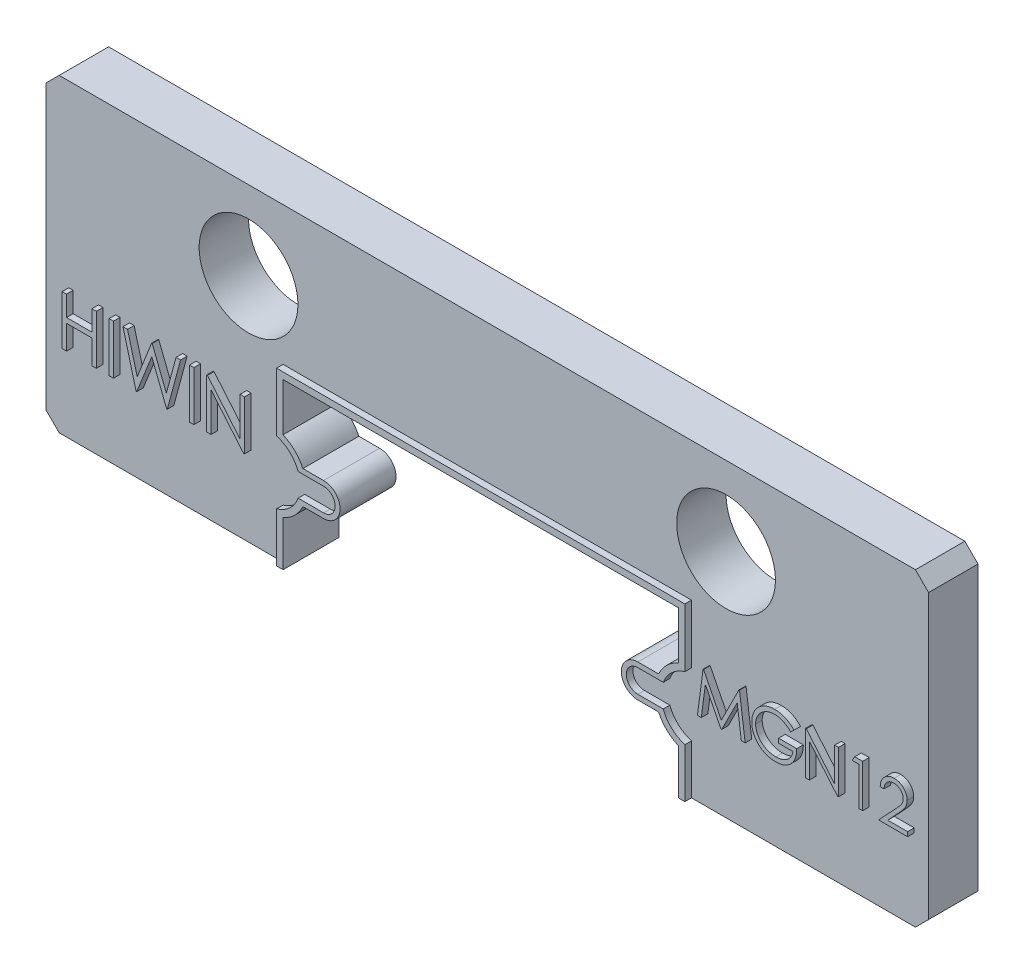
from build123d import *

# Parameters (mm, degrees)
BOSS_EXTRUDE1_DEPTH = 1.5
SKETCH2_R           = 1.5
CUT_EXTRUDE1_DEPTH  = 15.279355728
SKETCH3_W           = 0.134615385
SKETCH3_H           = 1.5
SKETCH3_W_2         = 0.134615384
BOSS_EXTRUDE2_DEPTH = 0.2
BOSS_EXTRUDE3_START = 0.2
BOSS_EXTRUDE3_DEPTH = 0.2


with BuildPart() as part:
    # Sketch1 → Boss-Extrude1 (new body)
    with BuildSketch(Plane.XY):
        with BuildLine():
            Line((-6, -4.7), (-13, -4.7))
            Line((-13, -4.7), (-13.4, -4.3))
            Line((-13.4, -4.3), (-13.4, 4.3))
            Line((-13.4, 4.3), (-13, 4.7))
            Line((-13, 4.7), (13, 4.7))
            Line((13, 4.7), (13.4, 4.3))
            Line((13.4, 4.3), (13.4, -4.3))
            Line((13.4, -4.3), (13, -4.7))
            Line((13, -4.7), (6, -4.7))
            Line((6, -4.7), (6, -3.328898526))
            ThreePointArc((6, -3.328898526), (5.646338178, -3.089180762), (5.400138898, -2.74))
            Line((5.400138898, -2.74), (4.77, -2.74))
            ThreePointArc((4.77, -2.74), (4.27, -2.24), (4.77, -1.74))
            Line((4.77, -1.74), (5.400138898, -1.74))
            ThreePointArc((5.400138898, -1.74), (5.646338178, -1.390819238), (6, -1.151101474))
            Line((6, -1.151101474), (6, 0.3))
            Line((6, 0.3), (-6, 0.3))
            Line((-6, 0.3), (-6, -1.151101474))
            ThreePointArc((-6, -1.151101474), (-5.646338178, -1.390819238), (-5.400138898, -1.74))
            Line((-5.400138898, -1.74), (-4.77, -1.74))
            ThreePointArc((-4.77, -1.74), (-4.27, -2.24), (-4.77, -2.74))
            Line((-4.77, -2.74), (-5.400138898, -2.74))
            ThreePointArc((-5.400138898, -2.74), (-5.646338178, -3.089180762), (-6, -3.328898526))
            Line((-6, -3.328898526), (-6, -4.7))
        make_face()
    extrude(amount=-BOSS_EXTRUDE1_DEPTH)

    # Sketch2 → Cut-Extrude1 (cut, through all)
    with BuildSketch(Plane.XY):
        with Locations((-7.25, 2.3)):
            Circle(SKETCH2_R)
        with Locations((7.25, 2.3)):
            Circle(SKETCH2_R)
    extrude(amount=-CUT_EXTRUDE1_DEPTH, mode=Mode.SUBTRACT)

    # Sketch3 → Boss-Extrude2 (add)
    with BuildSketch(Plane.XY):
        Polygon((-8.324615385, -2.24), (-8.324615385, -0.74), (-8.296370192, -0.74), (-7.305384615, -1.920588942), (-7.305384615, -0.74), (-7.170769231, -0.74), (-7.170769231, -2.24), (-7.201418269, -2.24), (-8.19, -1.062115385), (-8.19, -2.24), align=None)
        with Locations((-8.776538462, -1.49)):
            Rectangle(SKETCH3_W, SKETCH3_H)
        Polygon((-10.863076923, -0.74), (-10.723954327, -0.74), (-10.430384615, -1.840060096), (-9.993786058, -0.74), (-9.974254808, -0.74), (-9.545769231, -1.832548077), (-9.250697115, -0.74), (-9.113076923, -0.74), (-9.517524038, -2.24), (-9.536754808, -2.24), (-9.988076923, -1.092764423), (-10.444807692, -2.24), (-10.464038462, -2.24), align=None)
        with Locations((-11.218846154, -1.49)):
            Rectangle(SKETCH3_W_2, SKETCH3_H)
        Polygon((-12.709230769, -0.74), (-12.574615385, -0.74), (-12.574615385, -1.355384615), (-11.805384615, -1.355384615), (-11.805384615, -0.74), (-11.670769231, -0.74), (-11.670769231, -2.24), (-11.805384615, -2.24), (-11.805384615, -1.509230769), (-12.574615385, -1.509230769), (-12.574615385, -2.24), (-12.709230769, -2.24), align=None)
        Polygon((6.58, -2.24), (6.751614583, -0.94), (6.76828125, -0.94), (7.305, -2.006666667), (7.840416667, -0.94), (7.85734375, -0.94), (8.03, -2.24), (7.9128125, -2.24), (7.788333333, -1.304583333), (7.3190625, -2.24), (7.292760417, -2.24), (6.821666667, -1.3025), (6.697447917, -2.24), align=None)
        with BuildLine():
            Line((9.513333333, -1.161875), (9.413333333, -1.256666667))
            add(Edge.make_bspline(
                [(9.413333333, -1.256666667), (9.395237746, -1.239643775), (9.359478072, -1.206003911), (9.301178553, -1.16235697), (9.240352061, -1.124966704), (9.17731599, -1.094544388), (9.113631385, -1.070270506), (9.050143553, -1.052988625), (8.987503721, -1.041967397), (8.945841612, -1.040649431), (8.9253125, -1.04)],
                knots=[0, 0, 0, 0, 1.08915593, 2.152340314, 3.188132944, 4.216796309, 5.218260357, 6.173443236, 7.099959455, 8, 8, 8, 8], degree=3))
            add(Edge.make_bspline(
                [(8.9253125, -1.04), (8.912715611, -1.040153625), (8.887554505, -1.040460477), (8.85018064, -1.0443769), (8.813198746, -1.050009563), (8.776678636, -1.058159404), (8.740549301, -1.068488483), (8.704936398, -1.081408798), (8.669773495, -1.096472174), (8.635391807, -1.113878236), (8.60205962, -1.132999322), (8.57057851, -1.15418878), (8.540747819, -1.176767473), (8.513128232, -1.201300694), (8.487560877, -1.227566215), (8.463437196, -1.255075443), (8.441605629, -1.284579953), (8.421886054, -1.3155369), (8.404294596, -1.34740257), (8.388765667, -1.379870252), (8.375729606, -1.412832255), (8.365415237, -1.446329941), (8.356905565, -1.48010416), (8.350919025, -1.514388771), (8.347543957, -1.549220482), (8.346960153, -1.572545178), (8.346666667, -1.584270833)],
                knots=[0, 0, 0, 0, 1.02818874, 2.053710826, 3.065248034, 4.081641283, 5.106893873, 6.131558223, 7.173050175, 8.228653731, 9.27666206, 10.308777013, 11.325269123, 12.329503258, 13.32196095, 14.316845687, 15.314881793, 16.315733098, 17.311955233, 18.285320748, 19.252783886, 20.203351036, 21.145449891, 22.095197417, 23.042428769, 24, 24, 24, 24], degree=3))
            add(Edge.make_bspline(
                [(8.346666667, -1.584270833), (8.346947362, -1.596257137), (8.347507986, -1.620197013), (8.351096105, -1.65592624), (8.357755166, -1.691124818), (8.366657458, -1.725908411), (8.377793189, -1.760336588), (8.391674465, -1.794260092), (8.408115974, -1.827677666), (8.427146693, -1.860288209), (8.448015854, -1.892053904), (8.471394713, -1.921976012), (8.496228644, -1.950452986), (8.523422378, -1.976852556), (8.552103923, -2.00188086), (8.583130197, -2.02484834), (8.61589111, -2.046197394), (8.650436646, -2.065658958), (8.686391965, -2.083044986), (8.723258759, -2.09850529), (8.761154805, -2.111237615), (8.799880947, -2.121614625), (8.839391019, -2.13012045), (8.879885575, -2.135592514), (8.921066866, -2.139563394), (8.94882693, -2.139853729), (8.9628125, -2.14)],
                knots=[0, 0, 0, 0, 0.93586088, 1.869166235, 2.799637598, 3.729985548, 4.670839027, 5.622275134, 6.589130586, 7.576015415, 8.568469353, 9.55398029, 10.53834874, 11.515998671, 12.510579167, 13.508179873, 14.527009472, 15.561807829, 16.601455013, 17.643573243, 18.680854198, 19.719860599, 20.772568776, 21.833555941, 22.908541556, 24, 24, 24, 24], degree=3))
            add(Edge.make_bspline(
                [(8.9628125, -2.14), (8.979667315, -2.139647672), (9.012764482, -2.138955818), (9.061416589, -2.133569996), (9.108143444, -2.12515833), (9.152813748, -2.112839568), (9.195479384, -2.097126775), (9.236296762, -2.078185631), (9.274944521, -2.055289638), (9.311538843, -2.029447916), (9.345248655, -2.000656692), (9.375651615, -1.969588752), (9.402262797, -1.936394898), (9.425478828, -1.901270638), (9.444684899, -1.863925239), (9.460449366, -1.824541716), (9.47253316, -1.783102354), (9.477493579, -1.75446832), (9.48, -1.74)],
                knots=[0, 0, 0, 0, 1.13008108, 2.219097802, 3.278683437, 4.311054135, 5.322181354, 6.324827112, 7.324222904, 8.330512327, 9.32562643, 10.293043162, 11.24128371, 12.174520618, 13.111833804, 14.052305215, 15.015860969, 16, 16, 16, 16], degree=3))
            Line((9.48, -1.74), (9.046666667, -1.74))
            Line((9.046666667, -1.74), (9.046666667, -1.606666667))
            Line((9.046666667, -1.606666667), (9.596666667, -1.606666667))
            add(Edge.make_bspline(
                [(9.596666667, -1.606666667), (9.596033066, -1.63151802), (9.594792995, -1.680156607), (9.58609454, -1.751088421), (9.572048407, -1.818083622), (9.552860291, -1.881212763), (9.528020901, -1.940386383), (9.497796819, -1.995664562), (9.461704317, -2.046690186), (9.42102901, -2.093879816), (9.375380455, -2.135973523), (9.32599211, -2.172970015), (9.272782379, -2.204133843), (9.215801593, -2.229487804), (9.15523629, -2.249275287), (9.09094632, -2.26330473), (9.023018868, -2.271710145), (8.976465245, -2.272784086), (8.95265625, -2.273333333)],
                knots=[0, 0, 0, 0, 1.140356446, 2.231883559, 3.274166699, 4.278491846, 5.25512956, 6.21435461, 7.1637429, 8.11826594, 9.068280886, 10.0076534, 10.945064095, 11.891975133, 12.864533718, 13.863980011, 14.907571808, 16, 16, 16, 16], degree=3))
            add(Edge.make_bspline(
                [(8.95265625, -2.273333333), (8.937981057, -2.273121945), (8.909036846, -2.27270502), (8.866288787, -2.269742006), (8.824719385, -2.265180649), (8.784334696, -2.25829246), (8.744986169, -2.249855588), (8.706870323, -2.23905195), (8.669841962, -2.226546433), (8.633843853, -2.212322326), (8.599202736, -2.195841425), (8.565764315, -2.177526416), (8.533343754, -2.157471739), (8.502161893, -2.135330568), (8.472056262, -2.111268511), (8.443220983, -2.085237341), (8.415494628, -2.05731664), (8.398126456, -2.03749015), (8.389375, -2.0275)],
                knots=[0, 0, 0, 0, 1.107784379, 2.184907829, 3.233506516, 4.263428166, 5.276301166, 6.270063455, 7.25232949, 8.225834625, 9.190232166, 10.146266622, 11.1027726, 12.066435141, 13.031522626, 14.010570082, 14.99756817, 16, 16, 16, 16], degree=3))
            add(Edge.make_bspline(
                [(8.389375, -2.0275), (8.376677368, -2.0116509), (8.351492872, -1.98021578), (8.319075271, -1.929850086), (8.291440464, -1.877700824), (8.26901813, -1.823622819), (8.251509698, -1.767666654), (8.23895309, -1.709903832), (8.231596097, -1.650259969), (8.230536212, -1.609898585), (8.23, -1.589479167)],
                knots=[0, 0, 0, 0, 1.023165419, 2.029347347, 3.013907458, 3.994755782, 4.975994455, 5.96558838, 6.970761222, 8, 8, 8, 8], degree=3))
            add(Edge.make_bspline(
                [(8.23, -1.589479167), (8.230197688, -1.574188844), (8.230590553, -1.54380253), (8.235354316, -1.498689816), (8.242189128, -1.45437813), (8.252235177, -1.410903695), (8.264899504, -1.368237475), (8.280705085, -1.32635966), (8.299107475, -1.285245536), (8.320496373, -1.2451781), (8.344299172, -1.206689032), (8.370132111, -1.169933276), (8.39836202, -1.135580195), (8.428527888, -1.103194726), (8.460989628, -1.073183726), (8.495443128, -1.045269342), (8.531914941, -1.01941413), (8.570519808, -0.996025334), (8.610681519, -0.975015989), (8.652303805, -0.956597139), (8.695373961, -0.941374765), (8.73956931, -0.92845879), (8.785224381, -0.918907452), (8.832007867, -0.911980775), (8.880163622, -0.907241123), (8.912714148, -0.906859943), (8.92921875, -0.906666667)],
                knots=[0, 0, 0, 0, 1.008945113, 2.00506715, 2.99143336, 3.967273523, 4.948097931, 5.927297278, 6.919902385, 7.919676788, 8.923139349, 9.905703106, 10.883022732, 11.856032218, 12.825136022, 13.798837087, 14.781400844, 15.773989409, 16.776158564, 17.77167057, 18.775803737, 19.789618931, 20.80898985, 21.851988756, 22.910860228, 24, 24, 24, 24], degree=3))
            add(Edge.make_bspline(
                [(8.92921875, -0.906666667), (8.942678669, -0.906881906), (8.969368107, -0.907308702), (9.009083379, -0.910267), (9.048184784, -0.91495587), (9.086730301, -0.92135439), (9.124588665, -0.930069475), (9.161867727, -0.940498553), (9.198621526, -0.95264123), (9.234734876, -0.967122801), (9.270450599, -0.983559862), (9.305967283, -1.00206199), (9.341163574, -1.022945563), (9.37610051, -1.046272591), (9.4109984, -1.071642432), (9.445305267, -1.09978068), (9.479849218, -1.129577704), (9.50206132, -1.151002515), (9.513333333, -1.161875)],
                knots=[0, 0, 0, 0, 0.985871117, 1.954866573, 2.915460327, 3.869826059, 4.81536089, 5.759505086, 6.70452669, 7.649098992, 8.607881297, 9.583363685, 10.581137262, 11.603961102, 12.659522466, 13.73993555, 14.853081303, 16, 16, 16, 16], degree=3))
        make_face()
        Polygon((9.863333333, -2.24), (9.863333333, -0.94), (9.8878125, -0.94), (10.746666667, -1.963177083), (10.746666667, -0.94), (10.863333333, -0.94), (10.863333333, -2.24), (10.836770833, -2.24), (9.98, -1.219166667), (9.98, -2.24), align=None)
        Polygon((11.356302083, -0.94), (11.596666667, -0.94), (11.596666667, -2.24), (11.48, -2.24), (11.48, -1.073333333), (11.28, -1.073333333), align=None)
        with BuildLine():
            Line((12.246666667, -1.34), (12.13, -1.34))
            add(Edge.make_bspline(
                [(12.13, -1.34), (12.130760371, -1.324522242), (12.13225372, -1.294124336), (12.139247084, -1.249804028), (12.149253696, -1.207440817), (12.16340195, -1.167374849), (12.180972853, -1.129251864), (12.202044006, -1.093223286), (12.227001722, -1.059426559), (12.255307081, -1.028174989), (12.286049718, -0.99950532), (12.319220496, -0.974747658), (12.35407722, -0.953829666), (12.39051414, -0.936342347), (12.428942349, -0.923216119), (12.469013125, -0.913476653), (12.510902518, -0.907616867), (12.539443098, -0.906987004), (12.553958333, -0.906666667)],
                knots=[0, 0, 0, 0, 1.10065271, 2.161652631, 3.183658789, 4.190468796, 5.17591951, 6.163126047, 7.15150782, 8.156236427, 9.156009102, 10.134482811, 11.092018607, 12.041330605, 13.001268258, 13.972401359, 14.968799086, 16, 16, 16, 16], degree=3))
            add(Edge.make_bspline(
                [(12.553958333, -0.906666667), (12.568213047, -0.907000379), (12.596223049, -0.907656112), (12.637103226, -0.913287351), (12.676020506, -0.922107143), (12.71289882, -0.93448144), (12.747443929, -0.951115656), (12.779915346, -0.971097599), (12.810699647, -0.994207822), (12.838410738, -1.021416381), (12.863856596, -1.050462981), (12.885808862, -1.081472774), (12.904608037, -1.113500794), (12.920277747, -1.146791269), (12.931812884, -1.181657651), (12.940570505, -1.217592327), (12.945520687, -1.254967256), (12.946280415, -1.280263977), (12.946666667, -1.293125)],
                knots=[0, 0, 0, 0, 1.111607364, 2.184268762, 3.212621178, 4.221274766, 5.211760367, 6.196651075, 7.1921475, 8.207485113, 9.220403448, 10.201281604, 11.166441695, 12.114753415, 13.065576456, 14.026450734, 14.996634279, 16, 16, 16, 16], degree=3))
            add(Edge.make_bspline(
                [(12.946666667, -1.293125), (12.94603774, -1.311231339), (12.944790925, -1.347126275), (12.934125585, -1.399874653), (12.917468309, -1.45098078), (12.897412148, -1.492111778), (12.877179526, -1.525255647), (12.858947023, -1.552544023), (12.837602951, -1.581926054), (12.812836651, -1.613303351), (12.785160442, -1.646921687), (12.754323638, -1.682760754), (12.720106345, -1.720450268), (12.69609033, -1.746192349), (12.683645833, -1.75953125)],
                knots=[0, 0, 0, 0, 1.184426356, 2.348067706, 3.509069118, 4.696110526, 5.333549288, 6.050745305, 6.844228056, 7.710549037, 8.667450064, 9.695053472, 10.805634456, 12, 12, 12, 12], degree=3))
            Line((12.683645833, -1.75953125), (12.358385417, -2.106666667))
            Line((12.358385417, -2.106666667), (12.963333333, -2.106666667))
            Line((12.963333333, -2.106666667), (12.963333333, -2.24))
            Line((12.963333333, -2.24), (12.08, -2.24))
            Line((12.08, -2.24), (12.584166667, -1.701979167))
            add(Edge.make_bspline(
                [(12.584166667, -1.701979167), (12.596441596, -1.68916551), (12.620019223, -1.664553098), (12.653367038, -1.628619998), (12.683318662, -1.595284455), (12.710067979, -1.564609451), (12.73303471, -1.536146297), (12.753415824, -1.510816836), (12.769745901, -1.48750804), (12.787468762, -1.460490098), (12.804633955, -1.427502666), (12.819384259, -1.387190152), (12.828378346, -1.345691459), (12.829457284, -1.317647845), (12.83, -1.303541667)],
                knots=[0, 0, 0, 0, 1.329631726, 2.553950428, 3.673215718, 4.687767853, 5.603093632, 6.413772471, 7.123043292, 7.734684054, 8.834405432, 9.900288307, 10.943827018, 12, 12, 12, 12], degree=3))
            add(Edge.make_bspline(
                [(12.83, -1.303541667), (12.829763867, -1.294671433), (12.829298495, -1.277189906), (12.82519135, -1.251559195), (12.81898459, -1.226835121), (12.810090637, -1.202941634), (12.798350991, -1.180118964), (12.784060879, -1.158339328), (12.767573141, -1.137283427), (12.748499812, -1.117540773), (12.727546962, -1.099459183), (12.705411955, -1.083441665), (12.681993345, -1.07005571), (12.657389871, -1.059082411), (12.631670125, -1.050474412), (12.604784363, -1.044509797), (12.576806871, -1.040764874), (12.557703001, -1.040258182), (12.54796875, -1.04)],
                knots=[0, 0, 0, 0, 0.991446411, 1.95395049, 2.89581595, 3.838931463, 4.798493298, 5.75982156, 6.748411868, 7.785213223, 8.824556874, 9.840280684, 10.836137867, 11.835679398, 12.848801643, 13.863922112, 14.911575587, 16, 16, 16, 16], degree=3))
            add(Edge.make_bspline(
                [(12.54796875, -1.04), (12.537802441, -1.040265583), (12.517837488, -1.040787145), (12.488524704, -1.044435563), (12.460561415, -1.050729733), (12.43387728, -1.059338212), (12.408427148, -1.070279958), (12.384334789, -1.083908321), (12.361654287, -1.100170761), (12.340343007, -1.118608682), (12.320707815, -1.139136648), (12.303456118, -1.162020349), (12.288382056, -1.18684196), (12.275230055, -1.213534508), (12.26454937, -1.242340197), (12.256387914, -1.273156773), (12.249929942, -1.305850429), (12.247772492, -1.328427747), (12.246666667, -1.34)],
                knots=[0, 0, 0, 0, 1.031018746, 2.02475058, 2.990194455, 3.934040569, 4.864654155, 5.795059489, 6.735614925, 7.690564532, 8.649604399, 9.611025574, 10.590972636, 11.591080095, 12.624614302, 13.701020113, 14.821632451, 16, 16, 16, 16], degree=3))
        make_face()
    extrude(amount=BOSS_EXTRUDE2_DEPTH)

    # Sketch4 → Boss-Extrude3 (add)
    with BuildSketch(Plane.XY.offset(BOSS_EXTRUDE3_START)):
        with BuildLine():
            Line((-6.2, -4.7), (-6.2, -3.2))
            ThreePointArc((-6.2, -3.2), (-5.799452457, -2.972703925), (-5.5432503, -2.59))
            Line((-5.5432503, -2.59), (-4.77, -2.59))
            ThreePointArc((-4.77, -2.59), (-4.42, -2.24), (-4.77, -1.89))
            Line((-4.77, -1.89), (-5.5432503, -1.89))
            ThreePointArc((-5.5432503, -1.89), (-5.799452457, -1.507296075), (-6.2, -1.28))
            Line((-6.2, -1.28), (-6.2, 0.5))
            Line((-6.2, 0.5), (6.2, 0.5))
            Line((6.2, 0.5), (6.2, -1.28))
            ThreePointArc((6.2, -1.28), (5.799452457, -1.507296075), (5.5432503, -1.89))
            Line((5.5432503, -1.89), (4.77, -1.89))
            ThreePointArc((4.77, -1.89), (4.42, -2.24), (4.77, -2.59))
            Line((4.77, -2.59), (5.5432503, -2.59))
            ThreePointArc((5.5432503, -2.59), (5.799452457, -2.972703925), (6.2, -3.2))
            Line((6.2, -3.2), (6.2, -4.7))
            Line((6.2, -4.7), (6, -4.7))
            Line((6, -4.7), (6, -3.328898526))
            ThreePointArc((6, -3.328898526), (5.646338178, -3.089180762), (5.400138898, -2.74))
            Line((5.400138898, -2.74), (4.77, -2.74))
            ThreePointArc((4.77, -2.74), (4.27, -2.24), (4.77, -1.74))
            Line((4.77, -1.74), (5.400138898, -1.74))
            ThreePointArc((5.400138898, -1.74), (5.646338178, -1.390819238), (6, -1.151101474))
            Line((6, -1.151101474), (6, 0.3))
            Line((6, 0.3), (-6, 0.3))
            Line((-6, 0.3), (-6, -1.151101474))
            ThreePointArc((-6, -1.151101474), (-5.646338178, -1.390819238), (-5.400138898, -1.74))
            Line((-5.400138898, -1.74), (-4.77, -1.74))
            ThreePointArc((-4.77, -1.74), (-4.27, -2.24), (-4.77, -2.74))
            Line((-4.77, -2.74), (-5.400138898, -2.74))
            ThreePointArc((-5.400138898, -2.74), (-5.646338178, -3.089180762), (-6, -3.328898526))
            Line((-6, -3.328898526), (-6, -4.7))
            Line((-6, -4.7), (-6.2, -4.7))
        make_face()
    extrude(amount=-BOSS_EXTRUDE3_DEPTH)


solid = part.part
